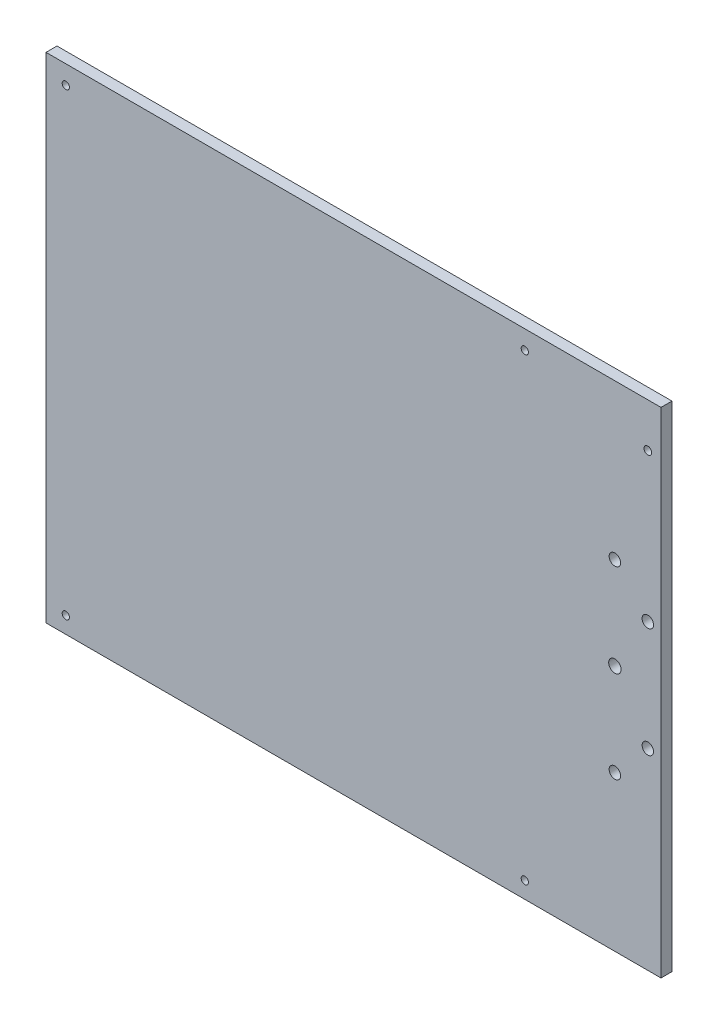
from build123d import *

# Parameters (mm, degrees)
SCHIZZO1_W                   = 280
SCHIZZO1_H                   = 225
ESTRUSIONE_ESTRUSIONE1_DEPTH = 5
FORO_FILETTATO_M4_1_D        = 3.3
SCHIZZO12_R                  = 2.6
SCHIZZO12_R_2                = 2.830640445
SCHIZZO12_R_3                = 1.75
TAGLIO_ESTRUSIONE1_DEPTH     = 10


with BuildPart() as part:
    # Schizzo1 → Estrusione-Estrusione1 (new body)
    with BuildSketch(Plane.XY):
        with Locations((-140, 132.5)):
            Rectangle(SCHIZZO1_W, SCHIZZO1_H)
    extrude(amount=ESTRUSIONE_ESTRUSIONE1_DEPTH)

    # Foro filettato M4-1 (through all)
    with Locations(Plane(origin=(0, 0, 0), x_dir=(-1, 0, 0), z_dir=(0, 0, -1))):
        with Locations((271, 27.5), (62, 27.5), (271, 236.5), (62, 236.5)):
            Hole(FORO_FILETTATO_M4_1_D / 2)

    # Schizzo12 → Taglio-Estrusione1 (cut)
    with BuildSketch(Plane(origin=(0, 0, 0), x_dir=(-1, 0, 0), z_dir=(0, 0, -1))):
        with Locations((6, 107.5)):
            Circle(SCHIZZO12_R)
        with Locations((6, 157.5)):
            Circle(SCHIZZO12_R)
        with Locations((21, 90.5)):
            Circle(SCHIZZO12_R)
        with Locations((21, 132.5)):
            Circle(SCHIZZO12_R_2)
        with Locations((21, 174.5)):
            Circle(SCHIZZO12_R)
        with Locations((6, 225)):
            Circle(SCHIZZO12_R_3)
    extrude(amount=-TAGLIO_ESTRUSIONE1_DEPTH, mode=Mode.SUBTRACT)


solid = part.part
